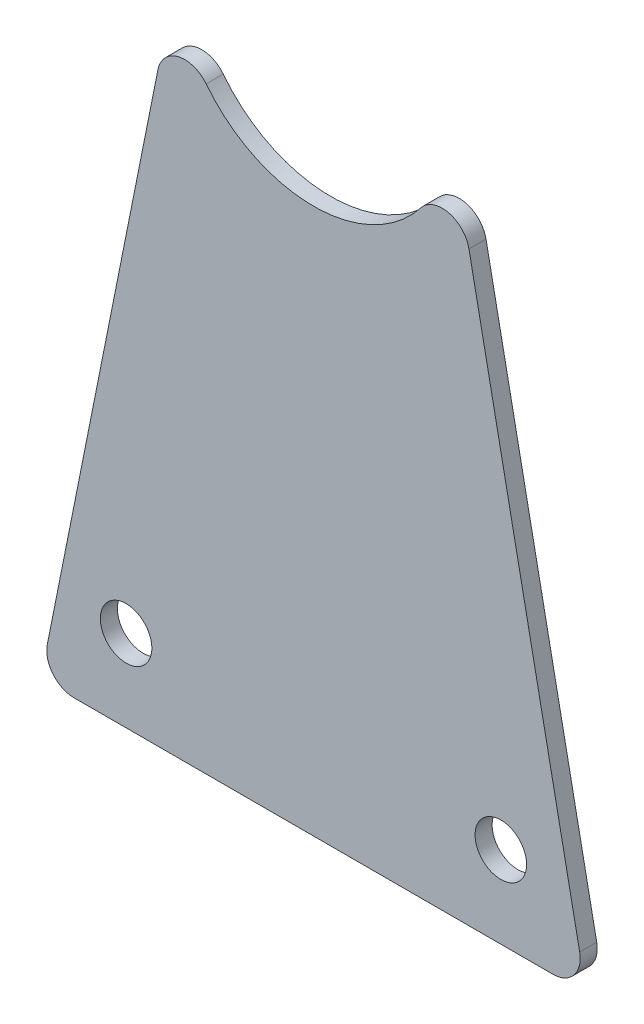
from build123d import *

# Parameters (mm, degrees)
BOSS_EXTRUDE1_DEPTH  = 0.79375
M4_CLEARANCE_HOLE1_D = 4.8
FILLET1_R            = 2.54


with BuildPart() as part:
    # Sketch1 → Boss-Extrude1 (new, symmetric)
    with BuildSketch(Plane.XY):
        with BuildLine():
            Line((-25.4, 0), (25.4, 0))
            Line((25.4, 0), (12.7, 63.5))
            ThreePointArc((12.7, 63.5), (0, 50.8), (-12.7, 63.5))
            Line((-12.7, 63.5), (-25.4, 0))
        make_face()
    extrude(amount=BOSS_EXTRUDE1_DEPTH, both=True)

    # M4 Clearance Hole1 (through all)
    with Locations(Plane.XY.offset(0.79375)):
        with Locations((17.45, 7.62), (-17.45, 7.62)):
            Hole(M4_CLEARANCE_HOLE1_D / 2)

    # Fillet1
    fillet1_edges = [part.edges().sort_by_distance(p)[0] for p in [
        (12.7, 63.5, 0),
        (25.4, 0, 0),
        (-25.4, 0, 0),
        (-12.7, 63.5, 0),
    ]]
    fillet(fillet1_edges, radius=FILLET1_R)


solid = part.part
